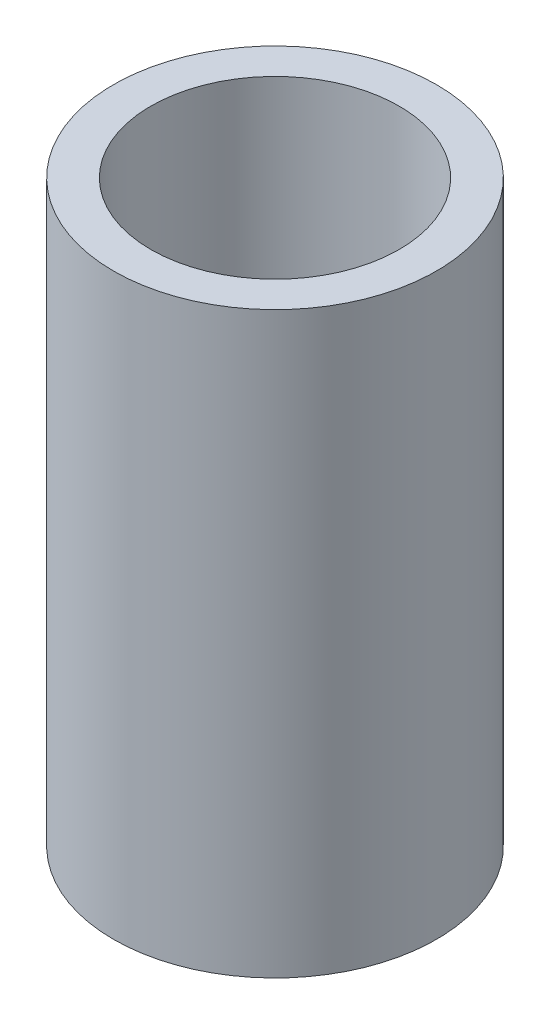
from build123d import *

# Parameters (mm, degrees)
SKETCH1_R           = 6.5
SKETCH1_R_2         = 5
BOSS_EXTRUDE1_DEPTH = 23.3


with BuildPart() as part:
    # Sketch1 → Boss-Extrude1 (new body)
    with BuildSketch(Plane(origin=(0, 0, 0), x_dir=(1, 0, 0), z_dir=(0, 1, 0))):
        with Locations(Location((0, 0, 0), (0, 0, 270))):
            Circle(SKETCH1_R)
        with Locations(Location((0, 0, 0), (0, 0, 270))):
            Circle(SKETCH1_R_2, mode=Mode.SUBTRACT)
    extrude(amount=BOSS_EXTRUDE1_DEPTH)


solid = part.part
